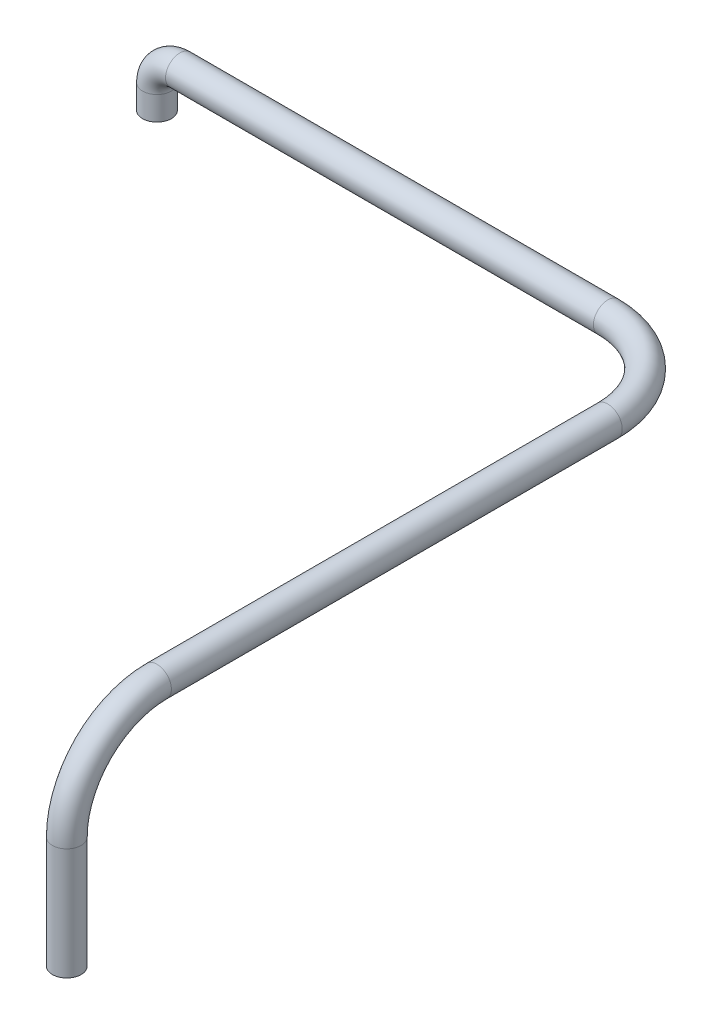
from build123d import *

# Parameters (mm, degrees)
SWEEP1_PROFILE_R                           = 4
HOLLOW_TUBE_OD_AND_WALL_PROVISIONAL_PROF_R = 3


with BuildPart() as part:
    # Sweep1: sweep along a curve in space
    with BuildLine() as sweep1_path:
        Line((0, 0, 0), (0, 31.000001606, 0))
        ThreePointArc((0, 31.000001606, 0), (0, 48.677670568, -7.322330568), (0, 56, -25))
        Line((0, 56, -25), (0, 56, -150.000001606))
        ThreePointArc((0, 56, -150.000001606), (-7.322330568, 56, -167.677670568), (-25, 56, -175))
        Line((-25, 56, -175), (-143.62999933, 56, -175))
        ThreePointArc((-143.62999933, 56, -175), (-148.134269763, 54.134270237, -175), (-150, 49.63, -175))
        Line((-150, 49.63, -175), (-150, 43, -175))
    # Sweep1 profile (on start of the path) → Sweep1 (sweep)
    with BuildSketch(Plane.ZX):
        Circle(SWEEP1_PROFILE_R)
    sweep(path=sweep1_path.line)

    # Hollow_tube_OD_and_wall_PROVISIONAL: sweep along a curve in space
    with BuildLine() as hollow_tube_od_and_wall_provisional_path:
        Line((0, 0, 0), (0, 31.000001606, 0))
        ThreePointArc((0, 31.000001606, 0), (0, 48.677670568, -7.322330568), (0, 56, -25))
        Line((0, 56, -25), (0, 56, -150.000001606))
        ThreePointArc((0, 56, -150.000001606), (-7.322330568, 56, -167.677670568), (-25, 56, -175))
        Line((-25, 56, -175), (-143.62999933, 56, -175))
        ThreePointArc((-143.62999933, 56, -175), (-148.134269763, 54.134270237, -175), (-150, 49.63, -175))
        Line((-150, 49.63, -175), (-150, 43, -175))
    # Hollow_tube_OD_and_wall_PROVISIONAL prof (on start of the path) → Hollow_tube_OD_and_wall_PROVISIONAL (sweep, cut)
    with BuildSketch(Plane.ZX):
        Circle(HOLLOW_TUBE_OD_AND_WALL_PROVISIONAL_PROF_R)
    sweep(path=hollow_tube_od_and_wall_provisional_path.line, mode=Mode.SUBTRACT)


solid = part.part
